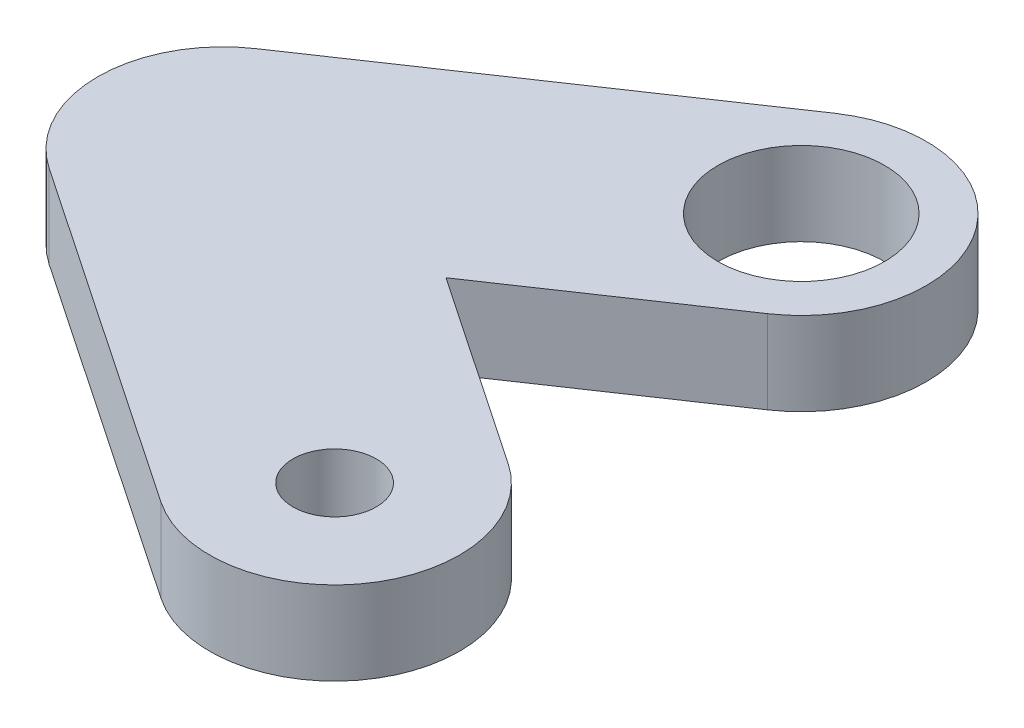
from build123d import *

# Parameters (mm, degrees)
SKETCH1_R           = 10
SKETCH1_R_2         = 5
BOSS_EXTRUDE1_DEPTH = 10


with BuildPart() as part:
    # Sketch1 → Boss-Extrude1 (new body)
    with BuildSketch(Plane(origin=(0, 0, 0), x_dir=(-1, 0, 0), z_dir=(0, 1, 0))):
        with BuildLine():
            Line((8.4, -12.427389106), (49.824630354, 15.572610894))
            ThreePointArc((49.824630354, 15.572610894), (56.424630354, 28), (49.824630354, 40.427389106))
            Line((49.824630354, 40.427389106), (8.4, 68.427389106))
            ThreePointArc((8.4, 68.427389106), (-12.427389106, 64.4), (-8.4, 43.572610894))
            Line((-8.4, 43.572610894), (14.638916069, 28))
            Line((14.638916069, 28), (-8.4, 12.427389106))
            ThreePointArc((-8.4, 12.427389106), (-12.427389106, -8.4), (8.4, -12.427389106))
        make_face()
        with Locations(Location((0, 0, 0), (0, 0, 90))):
            Circle(SKETCH1_R, mode=Mode.SUBTRACT)
        with Locations(Location((0, 56, 0), (0, 0, 90))):
            Circle(SKETCH1_R_2, mode=Mode.SUBTRACT)
    extrude(amount=BOSS_EXTRUDE1_DEPTH)


solid = part.part
